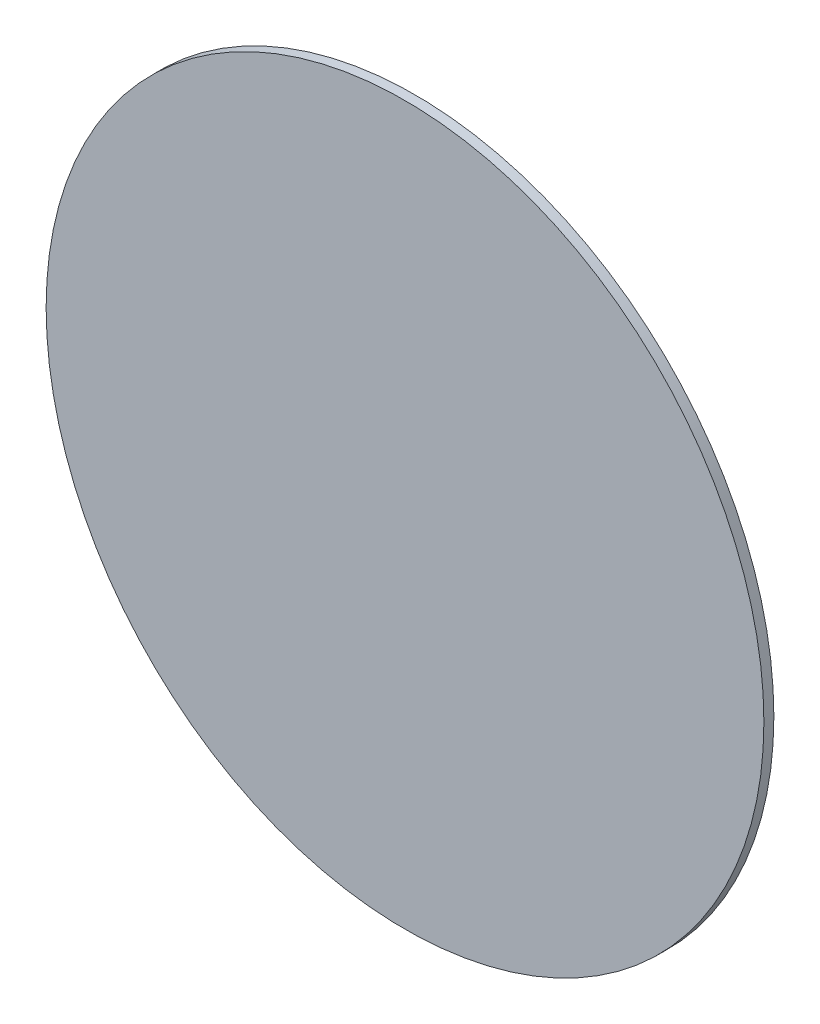
from build123d import *

# Parameters (mm, degrees)
SKETCH_1_R      = 360
EXTRUDE_1_DEPTH = 10


with BuildPart() as part:
    # Эскиз1 → Бобышка-Вытянуть1 (new body)
    with BuildSketch(Plane.XY):
        Circle(SKETCH_1_R)
    extrude(amount=EXTRUDE_1_DEPTH)


solid = part.part
